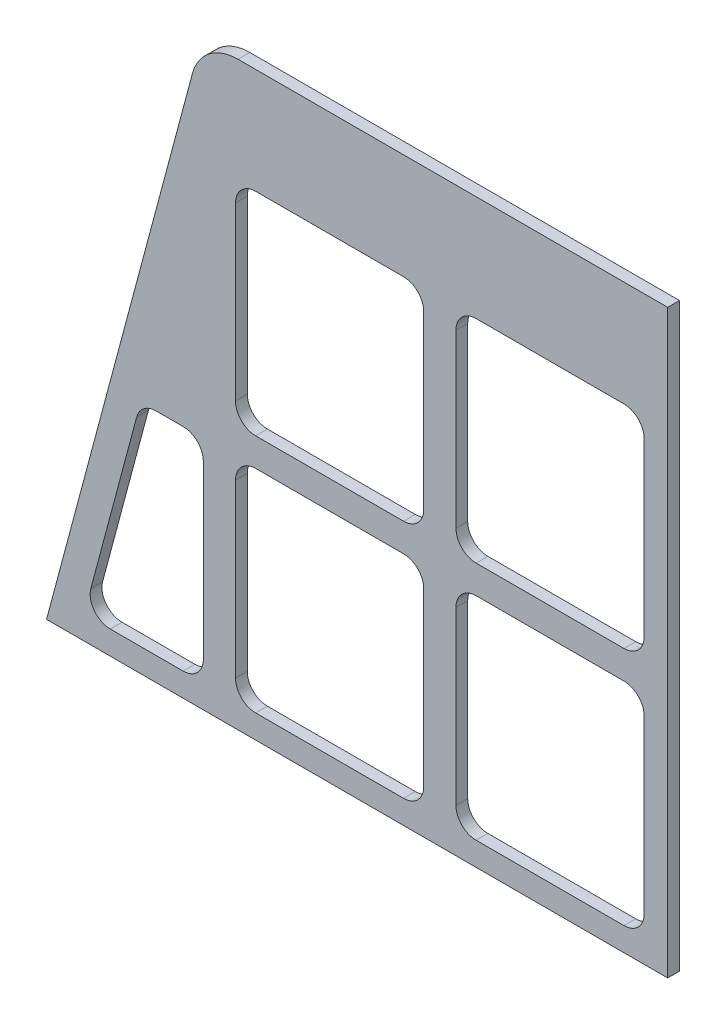
from build123d import *

# Parameters (mm, degrees)
BOSS_EXTRUDE1_DEPTH = 6.35
CUT_EXTRUDE1_DEPTH  = 6.35


with BuildPart() as part:
    # Sketch1 → Boss-Extrude1 (new body)
    with BuildSketch(Plane.XY):
        with BuildLine():
            Line((0, 0), (335.28, 0))
            Line((335.28, 0), (335.28, 313.51728))
            Line((335.28, 313.51728), (103.321320582, 313.51728))
            ThreePointArc((103.321320582, 313.51728), (87.853181888, 308.264157806), (78.783155215, 294.677648925))
            Line((78.783155215, 294.677648925), (0, 0))
        make_face()
    extrude(amount=BOSS_EXTRUDE1_DEPTH)

    # Sketch2 → Cut-Extrude1 (cut)
    with BuildSketch(Plane.XY.offset(6.35)):
        with BuildLine():
            Line((311.705446202, 12.7), (231.854553798, 12.7))
            ThreePointArc((231.854553798, 12.7), (224.165083065, 15.885083065), (220.98, 23.574553798))
            Line((220.98, 23.574553798), (220.98, 116.125446202))
            ThreePointArc((220.98, 116.125446202), (224.165083065, 123.814916935), (231.854553798, 127))
            Line((231.854553798, 127), (311.705446202, 127))
            ThreePointArc((311.705446202, 127), (319.394916935, 123.814916935), (322.58, 116.125446202))
            Line((322.58, 116.125446202), (322.58, 23.574553798))
            ThreePointArc((322.58, 23.574553798), (319.394916935, 15.885083065), (311.705446202, 12.7))
        make_face()
        with BuildLine():
            Line((203.603317785, 23.574553798), (203.603317785, 116.125446202))
            ThreePointArc((203.603317785, 116.125446202), (200.41823472, 123.814916935), (192.728763987, 127))
            Line((192.728763987, 127), (112.877871584, 127))
            ThreePointArc((112.877871584, 127), (105.18840085, 123.814916935), (102.003317785, 116.125446202))
            Line((102.003317785, 116.125446202), (102.003317785, 23.574553798))
            ThreePointArc((102.003317785, 23.574553798), (105.18840085, 15.885083065), (112.877871584, 12.7))
            Line((112.877871584, 12.7), (192.728763987, 12.7))
            ThreePointArc((192.728763987, 12.7), (200.41823472, 15.885083065), (203.603317785, 23.574553798))
        make_face()
        with BuildLine():
            Line((84.62663557, 23.574553798), (84.62663557, 116.125446202))
            ThreePointArc((84.62663557, 116.125446202), (81.441552505, 123.814916935), (73.752081772, 127))
            Line((73.752081772, 127), (59.157987156, 127))
            ThreePointArc((59.157987156, 127), (52.535581392, 124.750970083), (48.652412376, 118.934150328))
            Line((48.652412376, 118.934150328), (23.908590277, 26.383257925))
            ThreePointArc((23.908590277, 26.383257925), (25.788641176, 16.952148035), (34.414165057, 12.7))
            Line((34.414165057, 12.7), (73.752081772, 12.7))
            ThreePointArc((73.752081772, 12.7), (81.441552505, 15.885083065), (84.62663557, 23.574553798))
        make_face()
        with BuildLine():
            Line((203.603317785, 153.114553798), (203.603317785, 245.665446202))
            ThreePointArc((203.603317785, 245.665446202), (200.41823472, 253.354916935), (192.728763987, 256.54))
            Line((192.728763987, 256.54), (112.877871584, 256.54))
            ThreePointArc((112.877871584, 256.54), (105.18840085, 253.354916935), (102.003317785, 245.665446202))
            Line((102.003317785, 245.665446202), (102.003317785, 153.114553798))
            ThreePointArc((102.003317785, 153.114553798), (105.18840085, 145.425083065), (112.877871584, 142.24))
            Line((112.877871584, 142.24), (192.728763987, 142.24))
            ThreePointArc((192.728763987, 142.24), (200.41823472, 145.425083065), (203.603317785, 153.114553798))
        make_face()
        with BuildLine():
            Line((322.58, 153.114553798), (322.58, 245.665446202))
            ThreePointArc((322.58, 245.665446202), (319.394916935, 253.354916935), (311.705446202, 256.54))
            Line((311.705446202, 256.54), (231.854553798, 256.54))
            ThreePointArc((231.854553798, 256.54), (224.165083065, 253.354916935), (220.98, 245.665446202))
            Line((220.98, 245.665446202), (220.98, 153.114553798))
            ThreePointArc((220.98, 153.114553798), (224.165083065, 145.425083065), (231.854553798, 142.24))
            Line((231.854553798, 142.24), (311.705446202, 142.24))
            ThreePointArc((311.705446202, 142.24), (319.394916935, 145.425083065), (322.58, 153.114553798))
        make_face()
    extrude(amount=-CUT_EXTRUDE1_DEPTH, mode=Mode.SUBTRACT)


solid = part.part
